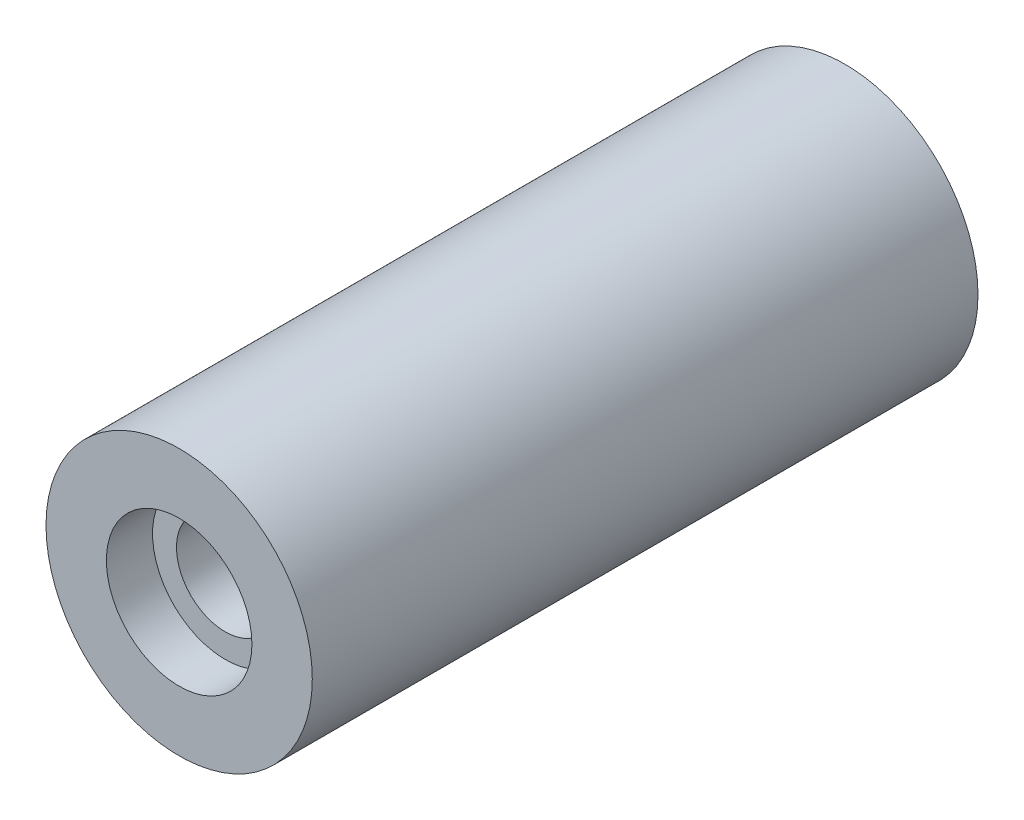
from build123d import *

# Parameters (mm, degrees)
SKETCH1_R           = 15
BOSS_EXTRUDE1_DEPTH = 75
SKETCH2_R           = 8.2
CUT_EXTRUDE1_DEPTH  = 5.2
CUT_EXTRUDE2_START  = -5.2
SKETCH3_R           = 8.2
CUT_EXTRUDE2_DEPTH  = 5.2
SKETCH4_R           = 5.5
CUT_EXTRUDE3_DEPTH  = 25
CUT_EXTRUDE4_START  = -25
SKETCH5_R           = 5.5
CUT_EXTRUDE4_DEPTH  = 25


with BuildPart() as part:
    # Sketch1 → Boss-Extrude1 (new body)
    with BuildSketch(Plane.XY):
        Circle(SKETCH1_R)
    extrude(amount=BOSS_EXTRUDE1_DEPTH)

    # Sketch2 → Cut-Extrude1 (cut)
    with BuildSketch(Plane.XY.offset(75)):
        Circle(SKETCH2_R)
    extrude(amount=-CUT_EXTRUDE1_DEPTH, mode=Mode.SUBTRACT)

    # Sketch3 → Cut-Extrude2 (cut)
    with BuildSketch(Plane(origin=(0, 0, 0), x_dir=(-1, 0, 0), z_dir=(0, 0, -1)).offset(CUT_EXTRUDE2_START)):
        with Locations(Location((0, 0, 0), (0, 0, 180))):
            Circle(SKETCH3_R)
    extrude(amount=CUT_EXTRUDE2_DEPTH, mode=Mode.SUBTRACT)

    # Sketch4 → Cut-Extrude3 (cut)
    with BuildSketch(Plane.XY.offset(69.8)):
        Circle(SKETCH4_R)
    extrude(amount=-CUT_EXTRUDE3_DEPTH, mode=Mode.SUBTRACT)

    # Sketch5 → Cut-Extrude4 (cut)
    with BuildSketch(Plane(origin=(0, 0, 5.2), x_dir=(-1, 0, 0), z_dir=(0, 0, -1)).offset(CUT_EXTRUDE4_START)):
        with Locations(Location((0, 0, 0), (0, 0, 180))):
            Circle(SKETCH5_R)
    extrude(amount=CUT_EXTRUDE4_DEPTH, mode=Mode.SUBTRACT)


solid = part.part
